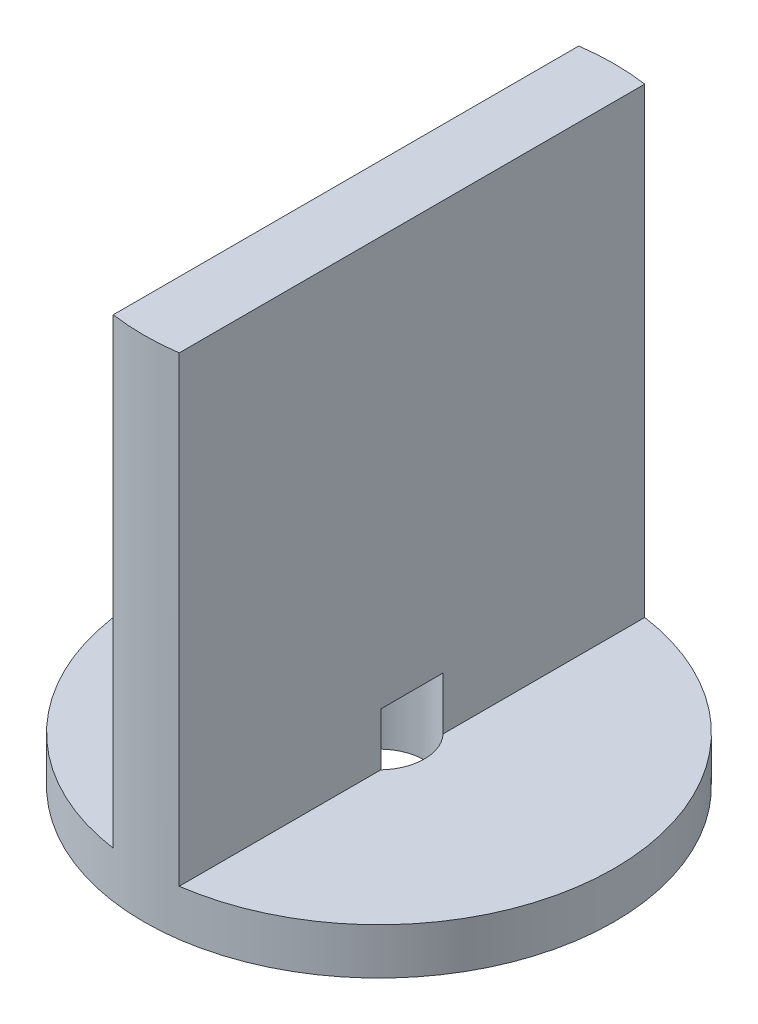
from build123d import *
from build123d.topology import SkipClean

# Parameters (mm, degrees)
SKETCH1_R                           = 36.195
SKETCH1_R_2                         = 6.985
BOSS_EXTRUDE1_DEPTH                 = 7.112
BOSS_EXTRUDE2_DEPTH                 = 71.12
CUT_EXTRUDE1_DEPTH                  = 8.128
F_9_64_0_14063_DIAMETER_HOLE2_D     = 3.572002
F_9_64_0_14063_DIAMETER_HOLE2_DEPTH = 5.588
F_9_64_0_14063_DIAMETER_HOLE2_TIP   = 1.073137666


with BuildPart() as part:
    # Sketch1 → Boss-Extrude1 (new body)
    with BuildSketch(Plane(origin=(0, 0, 0), x_dir=(1, 0, 0), z_dir=(0, 1, 0))):
        with Locations(Location((0, 0, 0), (0, 0, 270))):
            Circle(SKETCH1_R)
        with Locations(Location((0, 0, 0), (0, 0, 270))):
            Circle(SKETCH1_R_2, mode=Mode.SUBTRACT)
    extrude(amount=BOSS_EXTRUDE1_DEPTH)

    # Sketch7 → Boss-Extrude2 (add)
    with BuildSketch(Plane(origin=(0, 7.112, 0), x_dir=(1, 0, 0), z_dir=(0, 1, 0))):
        with BuildLine():
            ThreePointArc((5.08, -4.794144866), (0, -6.985), (-5.08, -4.794144866))
            Line((-5.08, -4.794144866), (-5.08, -35.836735691))
            ThreePointArc((-5.08, -35.836735691), (0, -36.195), (5.08, -35.836735691))
            Line((5.08, -35.836735691), (5.08, -4.794144866))
        make_face()
        with BuildLine():
            Line((-5.08, 35.836735691), (-5.08, 4.794144866))
            ThreePointArc((-5.08, 4.794144866), (0, 6.985), (5.08, 4.794144866))
            Line((5.08, 4.794144866), (5.08, 35.836735691))
            ThreePointArc((5.08, 35.836735691), (0, 36.195), (-5.08, 35.836735691))
        make_face()
        with BuildLine():
            Line((-5.08, 4.794144866), (-5.08, 0))
            Line((-5.08, 0), (5.08, 0))
            Line((5.08, 0), (5.08, 4.794144866))
            ThreePointArc((5.08, 4.794144866), (0, 6.985), (-5.08, 4.794144866))
        make_face()
        with BuildLine():
            Line((5.08, 0), (-5.08, 0))
            Line((-5.08, 0), (-5.08, -4.794144866))
            ThreePointArc((-5.08, -4.794144866), (0, -6.985), (5.08, -4.794144866))
            Line((5.08, -4.794144866), (5.08, 0))
        make_face()
    extrude(amount=BOSS_EXTRUDE2_DEPTH)

    # Sketch11 → Cut-Extrude1 (cut)
    with SkipClean():  # the faces are left unmerged after this step: merging them gives an invalid solid
        with BuildSketch(Plane.XZ.offset(-7.112)):
            with BuildLine():
                Line((-5.08, 4.794144866), (-5.08, -4.794144866))
                ThreePointArc((-5.08, -4.794144866), (0, -6.985), (5.08, -4.794144866))
                Line((5.08, -4.794144866), (5.08, 4.794144866))
                ThreePointArc((5.08, 4.794144866), (0, 6.985), (-5.08, 4.794144866))
            make_face()
        extrude(amount=-CUT_EXTRUDE1_DEPTH, mode=Mode.SUBTRACT)

    # 9/64 (0.14063) Diameter Hole2
    with Locations(Plane(origin=(0, 0, 0), x_dir=(-1, 0, 0), z_dir=(0, -1, 0))):
        with Locations((-19.05, 0), (19.05, 0)):
            Hole(F_9_64_0_14063_DIAMETER_HOLE2_D / 2, depth=F_9_64_0_14063_DIAMETER_HOLE2_DEPTH)
            with Locations((0, 0, -(F_9_64_0_14063_DIAMETER_HOLE2_DEPTH + F_9_64_0_14063_DIAMETER_HOLE2_TIP / 2))):  # 118° drill point
                Cone(0, F_9_64_0_14063_DIAMETER_HOLE2_D / 2, F_9_64_0_14063_DIAMETER_HOLE2_TIP, mode=Mode.SUBTRACT)


solid = part.part
